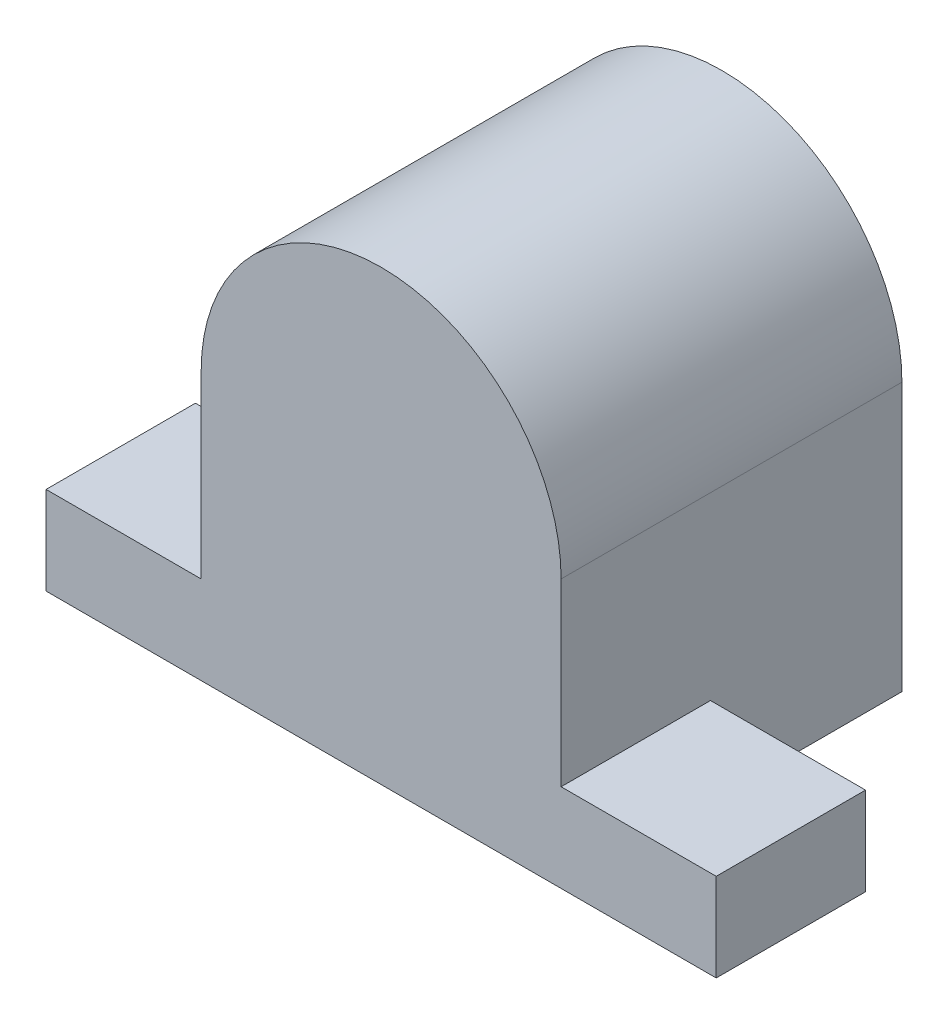
from build123d import *

# Parameters (mm, degrees)
SKETCH1_R           = 8.763
BOSS_EXTRUDE1_DEPTH = 3.556
BOSS_EXTRUDE2_DEPTH = 6.35
BOSS_EXTRUDE3_START = 12.7
SKETCH3_R           = 11.938
SKETCH3_R_2         = 8.763
BOSS_EXTRUDE3_DEPTH = 12.7
BOSS_EXTRUDE4_START = 12.7
SKETCH4_R           = 8.763
BOSS_EXTRUDE4_DEPTH = 12.7
BOSS_EXTRUDE5_START = 12.7
BOSS_EXTRUDE5_DEPTH = 12.7


with BuildPart() as part:
    # Sketch1 → Boss-Extrude1 (new body)
    with BuildSketch(Plane.XY):
        with BuildLine():
            Line((11.938, 0), (11.938, -11.938))
            Line((11.938, -11.938), (22.225, -11.938))
            Line((22.225, -11.938), (22.225, -17.78))
            Line((22.225, -17.78), (-22.225, -17.78))
            Line((-22.225, -17.78), (-22.225, -11.938))
            Line((-22.225, -11.938), (-11.938, -11.938))
            Line((-11.938, -11.938), (-11.938, 0))
            ThreePointArc((-11.938, 0), (0, 11.938), (11.938, 0))
        make_face()
        Circle(SKETCH1_R, mode=Mode.SUBTRACT)
    extrude(amount=BOSS_EXTRUDE1_DEPTH)

    # Sketch2 → Boss-Extrude2 (add)
    with BuildSketch(Plane.XY.offset(3.556)):
        with BuildLine():
            Line((-11.938, 0), (-11.938, -11.938))
            Line((-11.938, -11.938), (-22.225, -11.938))
            Line((-22.225, -11.938), (-22.225, -17.78))
            Line((-22.225, -17.78), (22.225, -17.78))
            Line((22.225, -17.78), (22.225, -11.938))
            Line((22.225, -11.938), (11.938, -11.938))
            Line((11.938, -11.938), (11.938, 0))
            ThreePointArc((11.938, 0), (0, 11.938), (-11.938, 0))
        make_face()
    extrude(amount=BOSS_EXTRUDE2_DEPTH)

    # Sketch3 → Boss-Extrude3 (add)
    with BuildSketch(Plane(origin=(0, 0, 0), x_dir=(-1, 0, 0), z_dir=(0, 0, -1)).offset(BOSS_EXTRUDE3_START)):
        Circle(SKETCH3_R)
        Circle(SKETCH3_R_2, mode=Mode.SUBTRACT)
    extrude(amount=-BOSS_EXTRUDE3_DEPTH)

    # Sketch4 → Boss-Extrude4 (add)
    with BuildSketch(Plane(origin=(0, 0, 3.556), x_dir=(-1, 0, 0), z_dir=(0, 0, -1)).offset(BOSS_EXTRUDE4_START)):
        Circle(SKETCH4_R)
    extrude(amount=-BOSS_EXTRUDE4_DEPTH)

    # Sketch5 → Boss-Extrude5 (add)
    with BuildSketch(Plane(origin=(0, 0, 0), x_dir=(-1, 0, 0), z_dir=(0, 0, -1)).offset(BOSS_EXTRUDE5_START)):
        with BuildLine():
            Line((-11.938, 0), (-11.938, -17.78))
            Line((-11.938, -17.78), (11.938, -17.78))
            Line((11.938, -17.78), (11.938, 0))
            ThreePointArc((11.938, 0), (0, -11.938), (-11.938, 0))
        make_face()
    extrude(amount=-BOSS_EXTRUDE5_DEPTH)


solid = part.part
